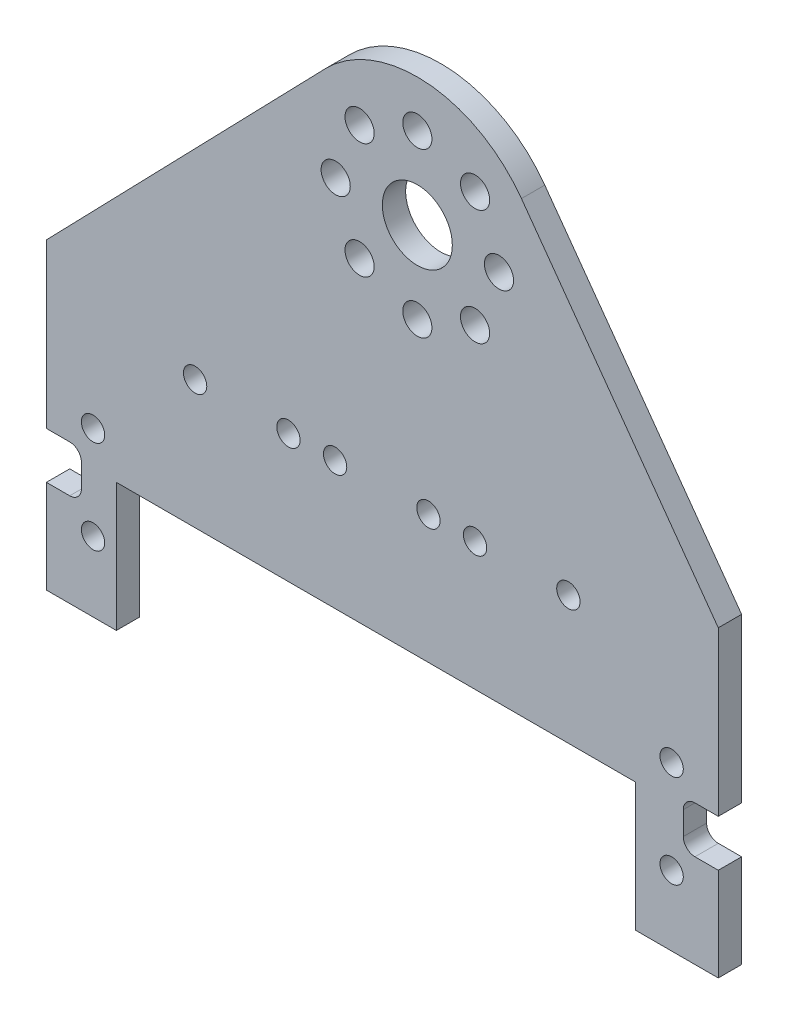
from build123d import *

# Parameters (mm, degrees)
SKETCH_1_R      = 3
SKETCH_1_R_2    = 1.25
SKETCH_1_R_3    = 1
EXTRUDE_1_DEPTH = 2


with BuildPart() as part:
    # 草圖1 → 填料-伸長1 (new body)
    with BuildSketch(Plane.XY):
        with BuildLine():
            Line((25.8, -18), (25.8, -17))
            Line((25.8, -17), (8.925896882, 6.428714091))
            ThreePointArc((8.925896882, 6.428714091), (0.800566406, 10.970829204), (-7.898074186, 7.656397596))
            Line((-7.898074186, 7.656397596), (-31.8, -17))
            Line((-31.8, -17), (-31.8, -18))
            Line((-31.8, -18), (-31.8, -31))
            Line((-31.8, -31), (-29.8, -31))
            ThreePointArc((-29.8, -31), (-29.092893219, -31.292893219), (-28.8, -32))
            Line((-28.8, -32), (-28.8, -34))
            ThreePointArc((-28.8, -34), (-29.092893219, -34.707106781), (-29.8, -35))
            Line((-29.8, -35), (-31.8, -35))
            Line((-31.8, -35), (-31.8, -36))
            Line((-31.8, -36), (-31.8, -42))
            Line((-31.8, -42), (-31.8, -43))
            Line((-31.8, -43), (-30.8, -43))
            Line((-30.8, -43), (-26.8, -43))
            Line((-26.8, -43), (-25.8, -43))
            Line((-25.8, -43), (-25.8, -32))
            Line((-25.8, -32), (18.7, -32))
            Line((18.7, -32), (18.7, -43))
            Line((18.7, -43), (19.7, -43))
            Line((19.7, -43), (20.7, -43))
            Line((20.7, -43), (24.8, -43))
            Line((24.8, -43), (25.8, -43))
            Line((25.8, -43), (25.8, -42))
            Line((25.8, -42), (25.8, -36))
            Line((25.8, -36), (25.8, -35))
            Line((25.8, -35), (23.8, -35))
            ThreePointArc((23.8, -35), (23.092893219, -34.707106781), (22.8, -34))
            Line((22.8, -34), (22.8, -32))
            ThreePointArc((22.8, -32), (23.092893219, -31.292893219), (23.8, -31))
            Line((23.8, -31), (25.8, -31))
            Line((25.8, -31), (25.8, -18))
        make_face()
        Circle(SKETCH_1_R, mode=Mode.SUBTRACT)
        with Locations((0, 7)):
            Circle(SKETCH_1_R_2, mode=Mode.SUBTRACT)
        with Locations((4.949747468, 4.949747468)):
            Circle(SKETCH_1_R_2, mode=Mode.SUBTRACT)
        with Locations((7, 0)):
            Circle(SKETCH_1_R_2, mode=Mode.SUBTRACT)
        with Locations((4.949747468, -4.949747468)):
            Circle(SKETCH_1_R_2, mode=Mode.SUBTRACT)
        with Locations((0, -7)):
            Circle(SKETCH_1_R_2, mode=Mode.SUBTRACT)
        with Locations((-4.949747468, -4.949747468)):
            Circle(SKETCH_1_R_2, mode=Mode.SUBTRACT)
        with Locations((-7, 0)):
            Circle(SKETCH_1_R_2, mode=Mode.SUBTRACT)
        with Locations((-4.949747468, 4.949747468)):
            Circle(SKETCH_1_R_2, mode=Mode.SUBTRACT)
        with Locations((-27.8, -29)):
            Circle(SKETCH_1_R_3, mode=Mode.SUBTRACT)
        with Locations((-27.8, -37)):
            Circle(SKETCH_1_R_3, mode=Mode.SUBTRACT)
        with Locations(Location((21.8, -37, 0), (0, 0, 180))):
            Circle(SKETCH_1_R_3, mode=Mode.SUBTRACT)
        with Locations(Location((21.8, -29, 0), (0, 0, 180))):
            Circle(SKETCH_1_R_3, mode=Mode.SUBTRACT)
        with Locations((-19.05, -21)):
            Circle(SKETCH_1_R_3, mode=Mode.SUBTRACT)
        with Locations((-11.05, -21)):
            Circle(SKETCH_1_R_3, mode=Mode.SUBTRACT)
        with Locations((4.95, -21)):
            Circle(SKETCH_1_R_3, mode=Mode.SUBTRACT)
        with Locations((12.95, -21)):
            Circle(SKETCH_1_R_3, mode=Mode.SUBTRACT)
        with Locations((-7.05, -21)):
            Circle(SKETCH_1_R_3, mode=Mode.SUBTRACT)
        with Locations((0.95, -21)):
            Circle(SKETCH_1_R_3, mode=Mode.SUBTRACT)
    extrude(amount=EXTRUDE_1_DEPTH)


solid = part.part
